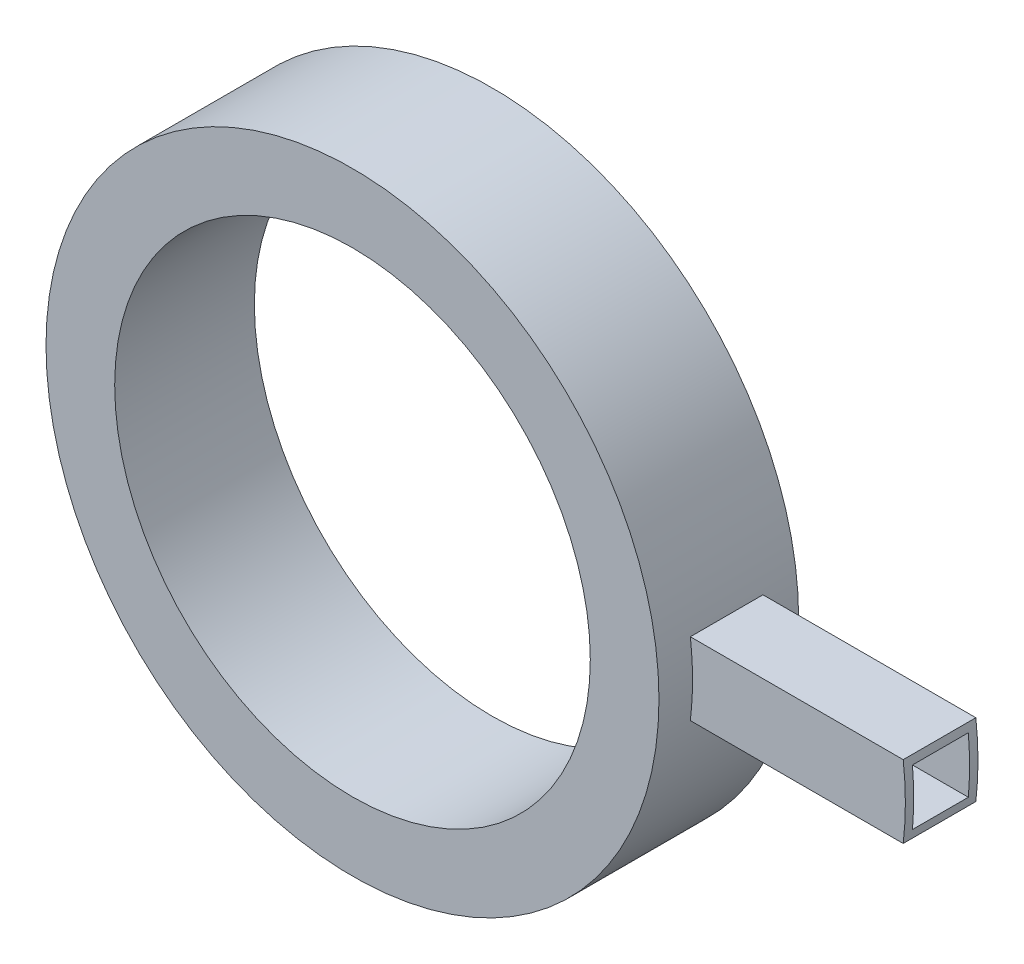
from build123d import *

# Parameters (mm, degrees)
SKETCH1_R                  = 109.714317711
SKETCH1_R_2                = 85.130943159
BOSS_EXTRUDE1_DEPTH        = 50
BOSS_EXTRUDE2_REACH        = 241.217
BOSS_EXTRUDE2_START_RADIUS = 109.714317711
BOSS_EXTRUDE2_END_RADIUS   = 109.714317711
SKETCH2_W                  = 26
SKETCH2_H                  = 26
SKETCH2_W_2                = 20
SKETCH2_H_2                = 20


with BuildPart() as part:
    # Sketch1 → Boss-Extrude1 (new body)
    with BuildSketch(Plane.XY):
        Circle(SKETCH1_R)
        Circle(SKETCH1_R_2, mode=Mode.SUBTRACT)
    extrude(amount=BOSS_EXTRUDE1_DEPTH)

    # Boss-Extrude2: from a cylinder face, 241.217 long prism both ways, kept between that surface and its translate by the depth
    boss_extrude2_start = Plane(origin=(0, 0, 25), z_dir=(0, 0, -1)) * Cylinder(BOSS_EXTRUDE2_START_RADIUS, 702.862635421, mode=Mode.PRIVATE)
    boss_extrude2_end = Plane(origin=(76.2, 0, 25), z_dir=(0, 0, -1)) * Cylinder(BOSS_EXTRUDE2_END_RADIUS, 702.862635421, mode=Mode.PRIVATE)
    # Sketch2 → Boss-Extrude2 (add, from a surface)
    with BuildSketch(Plane(origin=(0, 0, 0), x_dir=(0, 0, -1), z_dir=(1, 0, 0)), mode=Mode.PRIVATE) as boss_extrude2_sk1:
        with Locations((-25, 0)):
            Rectangle(SKETCH2_W, SKETCH2_H)
        with Locations((-25, 0)):
            Rectangle(SKETCH2_W_2, SKETCH2_H_2, mode=Mode.SUBTRACT)
    boss_extrude2_tool1 = extrude(boss_extrude2_sk1.sketch, amount=BOSS_EXTRUDE2_REACH, both=True, mode=Mode.PRIVATE)
    add(((boss_extrude2_tool1 - boss_extrude2_start) & boss_extrude2_end).solids().sort_by_distance((147.199526, 12.632304, 25))[0])


solid = part.part
